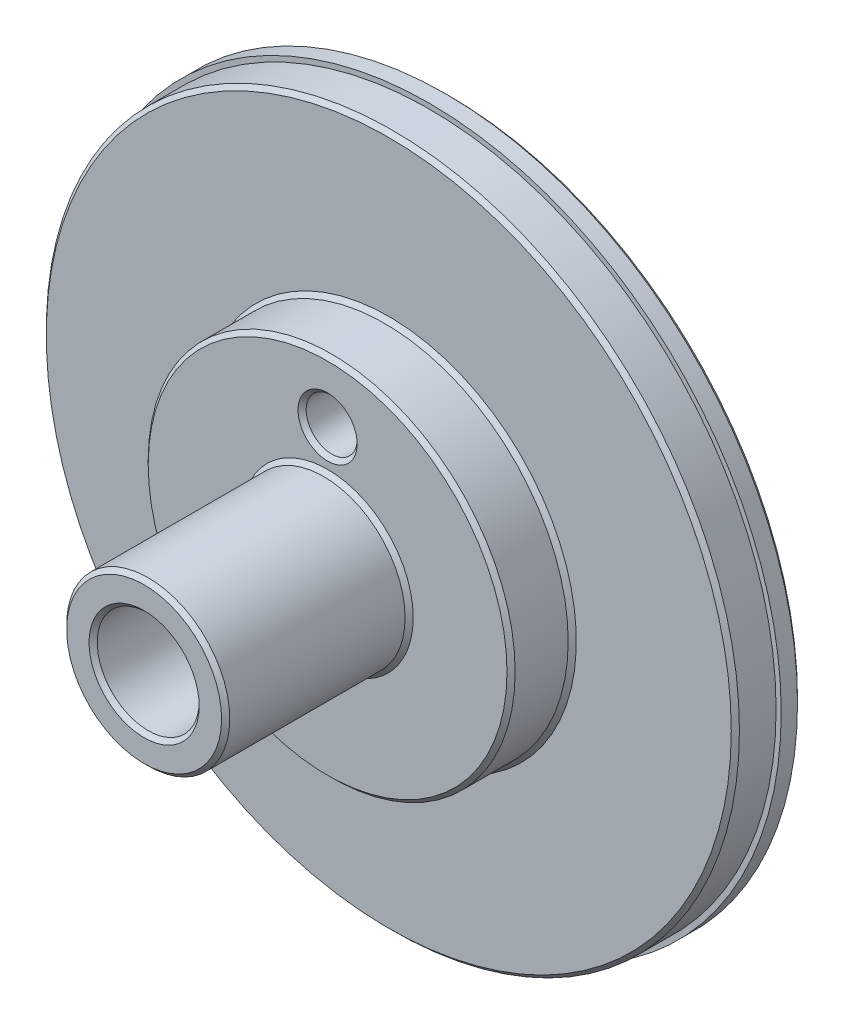
from build123d import *

# Parameters (mm, degrees)
SKETCH1_R           = 17.25
SKETCH1_R_2         = 17
BOSS_EXTRUDE1_DEPTH = 1
SKETCH1_3_R         = 17
SKETCH1_3_R_2       = 9
BOSS_EXTRUDE2_DEPTH = 3
SKETCH1_4_R         = 9
SKETCH1_4_R_2       = 4
BOSS_EXTRUDE3_DEPTH = 6
SKETCH1_5_R         = 4
BOSS_EXTRUDE4_DEPTH = 15
SKETCH2_R           = 2.5
CUT_EXTRUDE1_DEPTH  = 15
SKETCH3_R           = 1.25
CUT_EXTRUDE2_DEPTH  = 6
CHAMFER1_SIZE       = 0.2


with BuildPart() as part:
    # Sketch1 → Boss-Extrude1 (new body)
    with BuildSketch(Plane.XY):
        Circle(SKETCH1_R)
        Circle(SKETCH1_R_2, mode=Mode.SUBTRACT)
    extrude(amount=BOSS_EXTRUDE1_DEPTH)

    # Sketch1<3> → Boss-Extrude2 (add)
    with BuildSketch(Plane.XY):
        Circle(SKETCH1_3_R)
        Circle(SKETCH1_3_R_2, mode=Mode.SUBTRACT)
    extrude(amount=BOSS_EXTRUDE2_DEPTH)

    # Sketch1<4> → Boss-Extrude3 (add)
    with BuildSketch(Plane.XY):
        Circle(SKETCH1_4_R)
        Circle(SKETCH1_4_R_2, mode=Mode.SUBTRACT)
    extrude(amount=BOSS_EXTRUDE3_DEPTH)

    # Sketch1<5> → Boss-Extrude4 (add)
    with BuildSketch(Plane.XY):
        Circle(SKETCH1_5_R)
    extrude(amount=BOSS_EXTRUDE4_DEPTH)

    # Sketch2 → Cut-Extrude1 (cut)
    with BuildSketch(Plane.XY.offset(15)):
        Circle(SKETCH2_R)
    extrude(amount=-CUT_EXTRUDE1_DEPTH, mode=Mode.SUBTRACT)

    # Sketch3 → Cut-Extrude2 (cut)
    with BuildSketch(Plane.XY.offset(6)):
        with Locations((0, 6)):
            Circle(SKETCH3_R)
    extrude(amount=-CUT_EXTRUDE2_DEPTH, mode=Mode.SUBTRACT)

    # Chamfer1
    chamfer1_edges = [part.edges().sort_by_distance(p)[0] for p in [
        (-4, 0, 6),
        (-9, 0, 6),
        (-4, 0, 15),
        (-2.5, 0, 15),
        (-2.5, 0, 0),
        (-1.25, 6, 0),
        (-1.25, 6, 6),
        (-17.25, 0, 0),
        (-9, 0, 3),
        (-17, 0, 3),
    ]]
    chamfer(chamfer1_edges, length=CHAMFER1_SIZE)


solid = part.part
